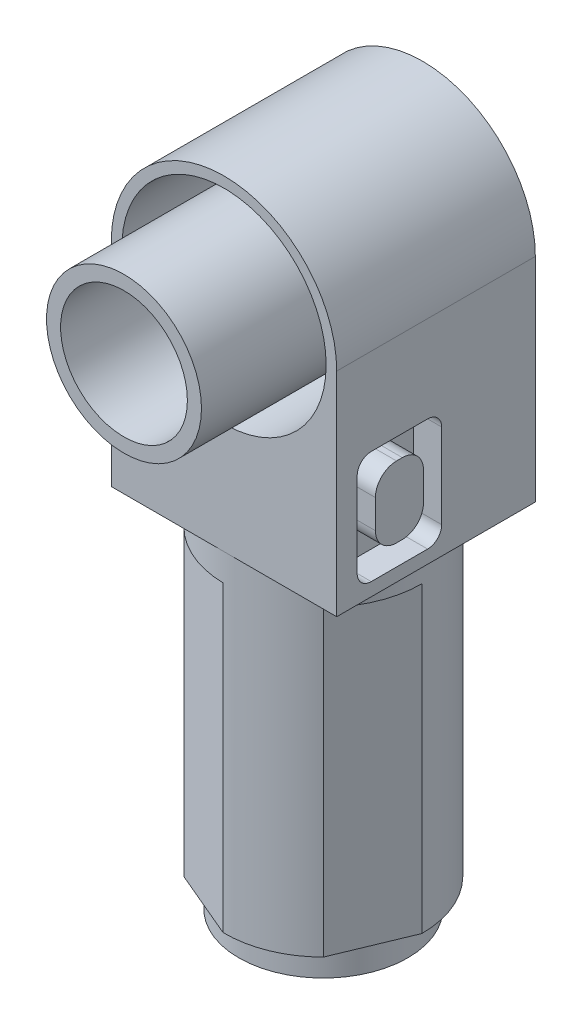
from build123d import *
from build123d.topology import SkipClean

# Parameters (mm, degrees)
BOSS_EXTRUDE1_DEPTH = 14.1
SKETCH2_R           = 7
BOSS_EXTRUDE2_DEPTH = 2
BOSS_EXTRUDE6_DEPTH = 21.5
SKETCH9_R           = 4.5
CUT_EXTRUDE6_DEPTH  = 20
SKETCH11_R          = 6
BOSS_EXTRUDE8_DEPTH = 2
CUT_EXTRUDE7_START  = 27
SKETCH3_R           = 4.5
CUT_EXTRUDE7_DEPTH  = 27
SKETCH12_R          = 4.5
CUT_EXTRUDE8_DEPTH  = 12
SKETCH12_3_R        = 7.25
SKETCH12_3_R_2      = 5.5
CUT_EXTRUDE9_DEPTH  = 12
BOSS_EXTRUDE9_START = 7.1
SKETCH12_4_R        = 5.5
SKETCH12_4_R_2      = 4.5
BOSS_EXTRUDE9_DEPTH = 7.1
SKETCH13_W          = 0.8
SKETCH13_H          = 2.25
SKETCH13_W_2        = 0.7
SKETCH13_H_2        = 1.6
CUT_EXTRUDE10_DEPTH = 2
CUT_EXTRUDE12_DEPTH = 2


with BuildPart() as part:
    # Sketch1 → Boss-Extrude1 (new body)
    with BuildSketch(Plane.XY):
        with BuildLine():
            ThreePointArc((8, 0), (0, 8), (-8, 0))
            Line((-8, 0), (-8, -15.1))
            Line((-8, -15.1), (8, -15.1))
            Line((8, -15.1), (8, 0))
        make_face()
    extrude(amount=BOSS_EXTRUDE1_DEPTH)

    # Sketch2 → Boss-Extrude2 (add)
    with BuildSketch(Plane.XZ.offset(15.1)):
        with Locations((0, 7.05)):
            Circle(SKETCH2_R)
    extrude(amount=BOSS_EXTRUDE2_DEPTH)

    # Sketch8 → Boss-Extrude6 (add)
    with SkipClean():  # the faces are left unmerged after this step: merging them gives an invalid solid
        with BuildSketch(Plane(origin=(0, -17.1, 0), x_dir=(-1, 0, 0), z_dir=(0, -1, 0))):
            with BuildLine():
                Line((7, -7.05), (4.949747468, -2.100252532))
                ThreePointArc((4.949747468, -2.100252532), (2.623124592, -0.560067999), (-0.120272225, -0.05103332))
                Line((-0.120272225, -0.05103332), (-4.949747468, -2.100252532))
                ThreePointArc((-4.949747468, -2.100252532), (-6.467156728, -4.371215973), (-7, -7.05))
                Line((-7, -7.05), (-4.949747468, -11.999747468))
                ThreePointArc((-4.949747468, -11.999747468), (-2.623124592, -13.539932001), (0.120272225, -14.04896668))
                Line((0.120272225, -14.04896668), (4.949747468, -11.999747468))
                ThreePointArc((4.949747468, -11.999747468), (6.467156728, -9.728784027), (7, -7.05))
            make_face()
        extrude(amount=BOSS_EXTRUDE6_DEPTH)

    # Sketch9 → Cut-Extrude6 (cut)
    with SkipClean():  # the faces are left unmerged after this step: merging them gives an invalid solid
        with BuildSketch(Plane(origin=(0, -38.6, 0), x_dir=(-1, 0, 0), z_dir=(0, -1, 0))):
            with Locations((0, -7.05)):
                Circle(SKETCH9_R)
        extrude(amount=-CUT_EXTRUDE6_DEPTH, mode=Mode.SUBTRACT)

    # Sketch11 → Boss-Extrude8 (add)
    with SkipClean():  # the faces are left unmerged after this step: merging them gives an invalid solid
        with BuildSketch(Plane(origin=(0, -38.6, 0), x_dir=(-1, 0, 0), z_dir=(0, -1, 0))):
            with Locations((0, -7.05)):
                Circle(SKETCH11_R)
        extrude(amount=BOSS_EXTRUDE8_DEPTH)

    # Sketch3 → Cut-Extrude7 (cut)
    with SkipClean():  # the faces are left unmerged after this step: merging them gives an invalid solid
        with BuildSketch(Plane.XZ.offset(17.1).offset(CUT_EXTRUDE7_START)):
            with Locations((0, 7.05)):
                Circle(SKETCH3_R)
        extrude(amount=-CUT_EXTRUDE7_DEPTH, mode=Mode.SUBTRACT)

    # Sketch12 → Cut-Extrude8 (cut)
    with SkipClean():  # the faces are left unmerged after this step: merging them gives an invalid solid
        with BuildSketch(Plane.XY.offset(14.1)):
            Circle(SKETCH12_R)
        extrude(amount=-CUT_EXTRUDE8_DEPTH, mode=Mode.SUBTRACT)

    # Sketch12<3> → Cut-Extrude9 (cut)
    with SkipClean():  # the faces are left unmerged after this step: merging them gives an invalid solid
        with BuildSketch(Plane.XY.offset(14.1)):
            Circle(SKETCH12_3_R)
            Circle(SKETCH12_3_R_2, mode=Mode.SUBTRACT)
        extrude(amount=-CUT_EXTRUDE9_DEPTH, mode=Mode.SUBTRACT)

    # Sketch12<4> → Boss-Extrude9 (add)
    with SkipClean():  # the faces are left unmerged after this step: merging them gives an invalid solid
        with BuildSketch(Plane.XY.offset(14.1).offset(BOSS_EXTRUDE9_START)):
            Circle(SKETCH12_4_R)
            Circle(SKETCH12_4_R_2, mode=Mode.SUBTRACT)
        extrude(amount=-BOSS_EXTRUDE9_DEPTH)

    # Sketch13 → Cut-Extrude10 (cut)
    with SkipClean():  # the faces are left unmerged after this step: merging them gives an invalid solid
        with BuildSketch(Plane.ZY.offset(8)):
            with Locations((10.5, -7.641192761)):
                Rectangle(SKETCH13_W, SKETCH13_H)
            with Locations((11.8, -10.441164669)):
                Rectangle(SKETCH13_W_2, SKETCH13_H_2)
            with Locations((9.2, -10.441164669)):
                Rectangle(SKETCH13_W_2, SKETCH13_H_2)
        extrude(amount=-CUT_EXTRUDE10_DEPTH, mode=Mode.SUBTRACT)

    # Sketch14 → Cut-Extrude12 (cut)
    with SkipClean():  # the faces are left unmerged after this step: merging them gives an invalid solid
        with BuildSketch(Plane(origin=(8, 0, 0), x_dir=(0, 0, -1), z_dir=(1, 0, 0))):
            with BuildLine():
                Line((-7.64754844, -14.165884792), (-11.64754844, -14.165884792))
                ThreePointArc((-11.64754844, -14.165884792), (-12.354655221, -13.872991573), (-12.64754844, -13.165884792))
                Line((-12.64754844, -13.165884792), (-12.64754844, -7.165884792))
                ThreePointArc((-12.64754844, -7.165884792), (-12.354655221, -6.45877801), (-11.64754844, -6.165884792))
                Line((-11.64754844, -6.165884792), (-7.64754844, -6.165884792))
                ThreePointArc((-7.64754844, -6.165884792), (-6.940441659, -6.45877801), (-6.64754844, -7.165884792))
                Line((-6.64754844, -7.165884792), (-6.64754844, -13.165884792))
                ThreePointArc((-6.64754844, -13.165884792), (-6.940441659, -13.872991573), (-7.64754844, -14.165884792))
            make_face()
            with BuildLine():
                Line((-9.441476419, -12.684690809), (-9.85362046, -12.684690809))
                ThreePointArc((-9.85362046, -12.684690809), (-10.914280632, -12.245350981), (-11.35362046, -11.184690809))
                Line((-11.35362046, -11.184690809), (-11.35362046, -9.147078774))
                ThreePointArc((-11.35362046, -9.147078774), (-10.914280632, -8.086418602), (-9.85362046, -7.647078774))
                Line((-9.85362046, -7.647078774), (-9.441476419, -7.647078774))
                ThreePointArc((-9.441476419, -7.647078774), (-8.380816248, -8.086418602), (-7.941476419, -9.147078774))
                Line((-7.941476419, -9.147078774), (-7.941476419, -11.184690809))
                ThreePointArc((-7.941476419, -11.184690809), (-8.380816248, -12.245350981), (-9.441476419, -12.684690809))
            make_face(mode=Mode.SUBTRACT)
        extrude(amount=-CUT_EXTRUDE12_DEPTH, mode=Mode.SUBTRACT)


solid = part.part
